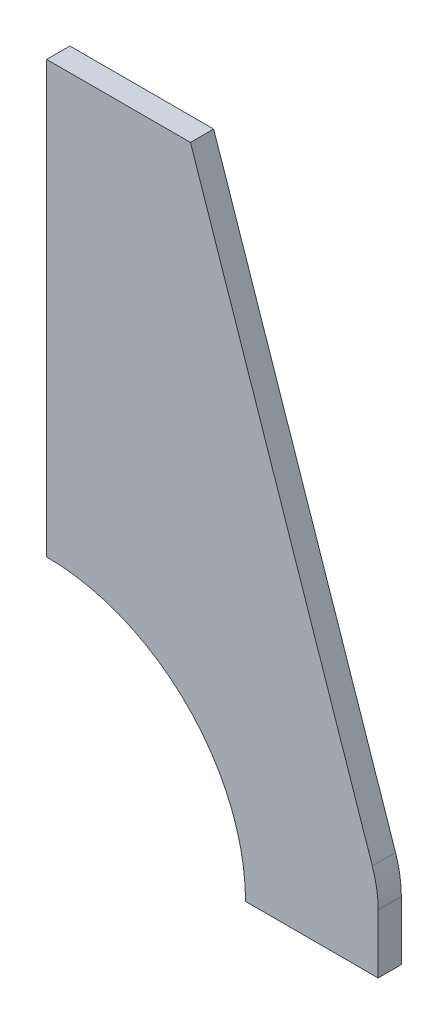
from build123d import *

# Parameters (mm, degrees)
BOSS_EXTRUDE1_DEPTH = 7
FILLET1_R           = 33
SKETCH2_R           = 60
CUT_EXTRUDE1_DEPTH  = 259.610511066
SKETCH3_W           = 181.044086137
SKETCH3_H           = 480.78858802
CUT_EXTRUDE2_DEPTH  = 259.610511066
SKETCH4_W           = 169.768954509
SKETCH4_H           = 49.097500459
CUT_EXTRUDE3_DEPTH  = 215.823183106


with BuildPart() as part:
    # Sketch1 → Boss-Extrude1 (new body)
    with BuildSketch(Plane.XY):
        with BuildLine():
            Line((-100, 0), (100, 0))
            Line((100, 0), (100, 23.252721757))
            Line((100, 23.252721757), (26.948185903, 238.391267529))
            Line((26.948185903, 238.391267529), (24.948185903, 238.391267529))
            ThreePointArc((24.948185903, 238.391267529), (0, 215), (-24.948185903, 238.391267529))
            Line((-24.948185903, 238.391267529), (-26.948185903, 238.391267529))
            Line((-26.948185903, 238.391267529), (-100, 23.252721757))
            Line((-100, 23.252721757), (-100, 0))
        make_face()
    extrude(amount=BOSS_EXTRUDE1_DEPTH)

    # Fillet1
    fillet1_edges = [part.edges().sort_by_distance(p)[0] for p in [
        (-100, 23.252721757, 3.5),
        (100, 23.252721757, 3.5),
    ]]
    fillet(fillet1_edges, radius=FILLET1_R)

    # Sketch2 → Cut-Extrude1 (cut, through all)
    with BuildSketch(Plane.XY.offset(7)):
        Circle(SKETCH2_R)
    extrude(amount=-CUT_EXTRUDE1_DEPTH, mode=Mode.SUBTRACT)

    # Sketch3 → Cut-Extrude2 (cut, through all)
    with BuildSketch(Plane(origin=(0, 0, 0), x_dir=(0, 0, -1), z_dir=(1, 0, 0))):
        with Locations((-2.723537344, 108.130535203)):
            Rectangle(SKETCH3_W, SKETCH3_H)
    extrude(amount=-CUT_EXTRUDE2_DEPTH, mode=Mode.SUBTRACT)

    # Sketch4 → Cut-Extrude3 (cut, through all)
    with BuildSketch(Plane(origin=(0, 190, 0), x_dir=(1, 0, 0), z_dir=(0, 1, 0))):
        with Locations((45.695998337, 2.995854363)):
            Rectangle(SKETCH4_W, SKETCH4_H)
    extrude(amount=CUT_EXTRUDE3_DEPTH, mode=Mode.SUBTRACT)


solid = part.part
